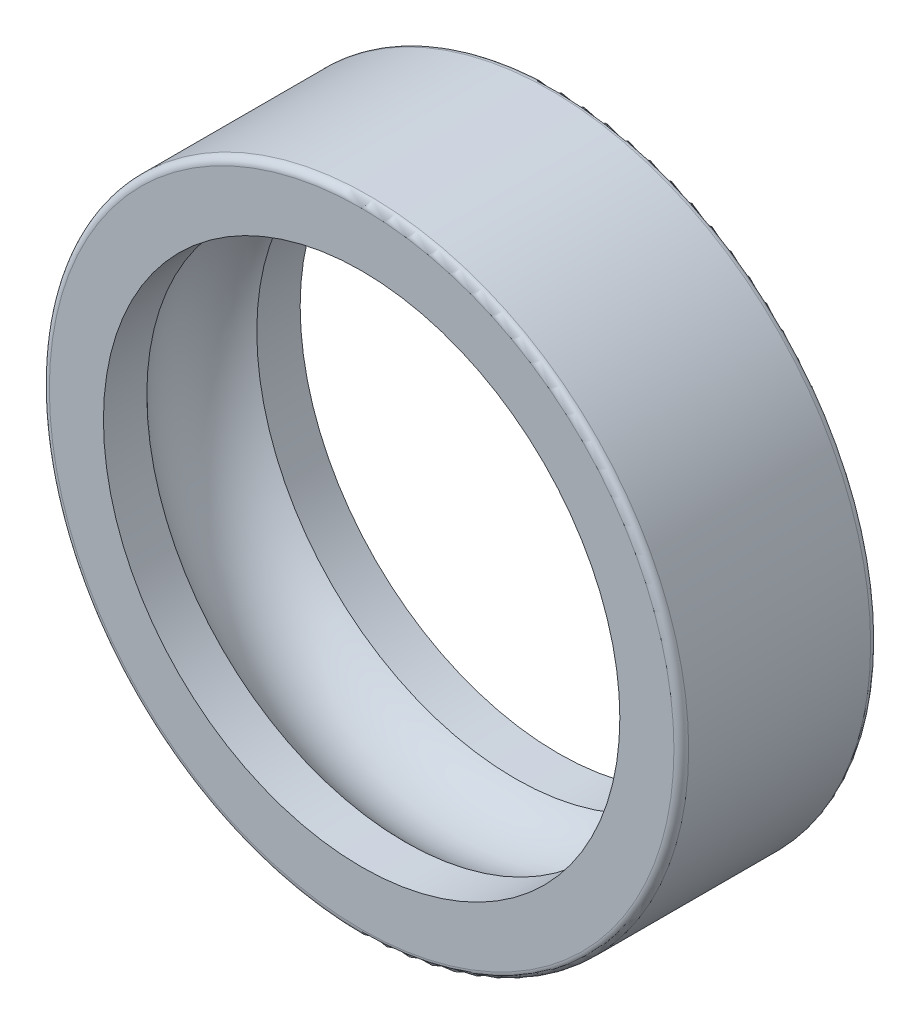
from build123d import *


with BuildPart() as part:
    # Sketch1 → Revolve1 (revolve)
    with BuildSketch(Plane(origin=(0, 0, 0), x_dir=(0, 0, -1), z_dir=(1, 0, 0)), mode=Mode.PRIVATE) as revolve1_sk:
        with BuildLine():
            Line((-3.7, 13), (3.7, 13))
            ThreePointArc((3.7, 13), (3.912132034, 12.912132034), (4, 12.7))
            Line((4, 12.7), (4, 10.5))
            Line((4, 10.5), (2.236067977, 10.5))
            ThreePointArc((2.236067977, 10.5), (0, 11.5), (-2.236067977, 10.5))
            Line((-2.236067977, 10.5), (-4, 10.5))
            Line((-4, 10.5), (-4, 12.7))
            ThreePointArc((-4, 12.7), (-3.912132034, 12.912132034), (-3.7, 13))
        make_face()
    revolve(revolve1_sk.sketch.rotate(Axis((0, 0, 8.516129032), (0, 0, -1)), 90), axis=Axis((0, 0, 8.516129032), (0, 0, -1)))


solid = part.part
